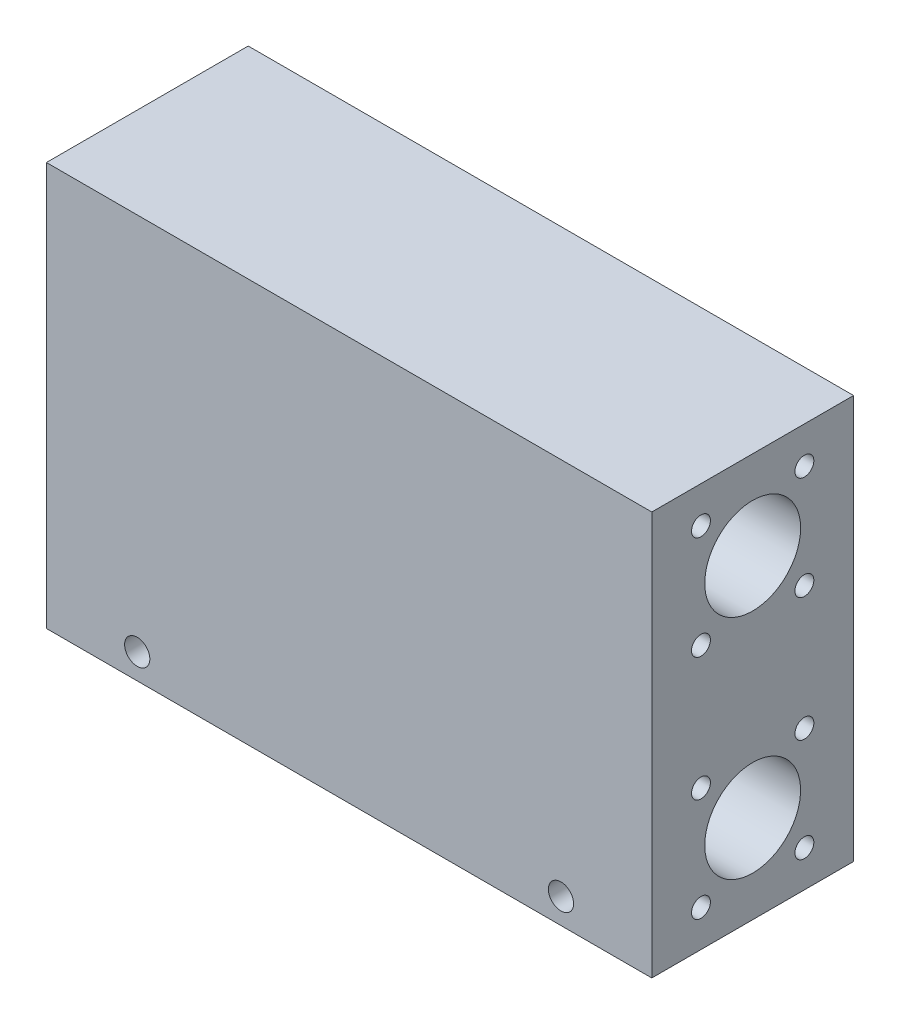
from build123d import *

# Parameters (mm, degrees)
SKETCH1_W                        = 120
SKETCH1_H                        = 80
BOSS_EXTRUDE1_DEPTH              = 40
SKETCH2_R                        = 1.85
LINEAR_BEARING_SCREW_CUTS_DEPTH  = 14
SKETCH3_R                        = 9.5
LINEAR_BEARINGS_HOLE_DEPTH       = 55
SKETCH4_R                        = 1.875
LINEAR_BEARING_SCREW_CUTS2_DEPTH = 14
CUT_EXTRUDE4_START               = -55
SKETCH5_R                        = 9.5
CUT_EXTRUDE4_DEPTH               = 55
SKETCH11_R                       = 6
CUT_EXTRUDE9_DEPTH               = 111.566721937
SKETCH13_R                       = 2.5
CUT_EXTRUDE11_DEPTH              = 150.666295471


with BuildPart() as part:
    # Sketch1 → Boss-Extrude1 (new body)
    with BuildSketch(Plane.XY):
        with Locations((60, 40)):
            Rectangle(SKETCH1_W, SKETCH1_H)
    extrude(amount=BOSS_EXTRUDE1_DEPTH)

    # Sketch2 → linear-bearing-screw-cuts (cut)
    with BuildSketch(Plane.ZY):
        with Locations((30.25, 72.75)):
            Circle(SKETCH2_R)
        with Locations(Location((9.75, 72.75, 0), (0, 0, 180))):
            Circle(SKETCH2_R)
        with Locations(Location((30.25, 52.25, 0), (0, 0, 180))):
            Circle(SKETCH2_R)
        with Locations((9.75, 52.25)):
            Circle(SKETCH2_R)
        with Locations(Location((9.75, 27.75, 0), (0, 0, 180))):
            Circle(SKETCH2_R)
        with Locations((30.25, 27.75)):
            Circle(SKETCH2_R)
        with Locations(Location((30.25, 7.25, 0), (0, 0, 180))):
            Circle(SKETCH2_R)
        with Locations((9.75, 7.25)):
            Circle(SKETCH2_R)
    extrude(amount=-LINEAR_BEARING_SCREW_CUTS_DEPTH, mode=Mode.SUBTRACT)

    # Sketch3 → linear-bearings-hole (cut)
    with BuildSketch(Plane.ZY):
        with Locations((20, 62.5)):
            Circle(SKETCH3_R)
        with Locations(Location((20, 17.5, 0), (0, 0, 180))):
            Circle(SKETCH3_R)
    extrude(amount=-LINEAR_BEARINGS_HOLE_DEPTH, mode=Mode.SUBTRACT)

    # Sketch4 → linear-bearing-screw-cuts2 (cut)
    with BuildSketch(Plane(origin=(120, 0, 0), x_dir=(0, 0, -1), z_dir=(1, 0, 0))):
        with Locations((-9.75, 72.75)):
            Circle(SKETCH4_R)
        with Locations(Location((-30.25, 72.75, 0), (0, 0, 180))):
            Circle(SKETCH4_R)
        with Locations(Location((-9.75, 52.25, 0), (0, 0, 180))):
            Circle(SKETCH4_R)
        with Locations((-30.25, 52.25)):
            Circle(SKETCH4_R)
        with Locations(Location((-30.25, 27.75, 0), (0, 0, 180))):
            Circle(SKETCH4_R)
        with Locations((-9.75, 27.75)):
            Circle(SKETCH4_R)
        with Locations(Location((-9.75, 7.25, 0), (0, 0, 180))):
            Circle(SKETCH4_R)
        with Locations((-30.25, 7.25)):
            Circle(SKETCH4_R)
    extrude(amount=-LINEAR_BEARING_SCREW_CUTS2_DEPTH, mode=Mode.SUBTRACT)

    # Sketch5 → Cut-Extrude4 (cut)
    with BuildSketch(Plane(origin=(120, 0, 0), x_dir=(0, 0, -1), z_dir=(1, 0, 0)).offset(CUT_EXTRUDE4_START)):
        with Locations(Location((-20, 62.5, 0), (0, 0, 180))):
            Circle(SKETCH5_R)
        with Locations((-20, 17.5)):
            Circle(SKETCH5_R)
    extrude(amount=CUT_EXTRUDE4_DEPTH, mode=Mode.SUBTRACT)

    # Sketch11 → Cut-Extrude9 (cut, through all)
    with BuildSketch(Plane(origin=(65, 0, 0), x_dir=(0, 0, -1), z_dir=(1, 0, 0))):
        with Locations((-20, 62.5)):
            Circle(SKETCH11_R)
        with Locations((-20, 17.5)):
            Circle(SKETCH11_R)
    extrude(amount=-CUT_EXTRUDE9_DEPTH, mode=Mode.SUBTRACT)

    # Sketch13 → Cut-Extrude11 (cut, through all)
    with BuildSketch(Plane(origin=(0, 0, 0), x_dir=(-1, 0, 0), z_dir=(0, 0, -1))):
        with Locations((-102, 5)):
            Circle(SKETCH13_R)
        with Locations((-18, 5)):
            Circle(SKETCH13_R)
    extrude(amount=-CUT_EXTRUDE11_DEPTH, mode=Mode.SUBTRACT)


solid = part.part
